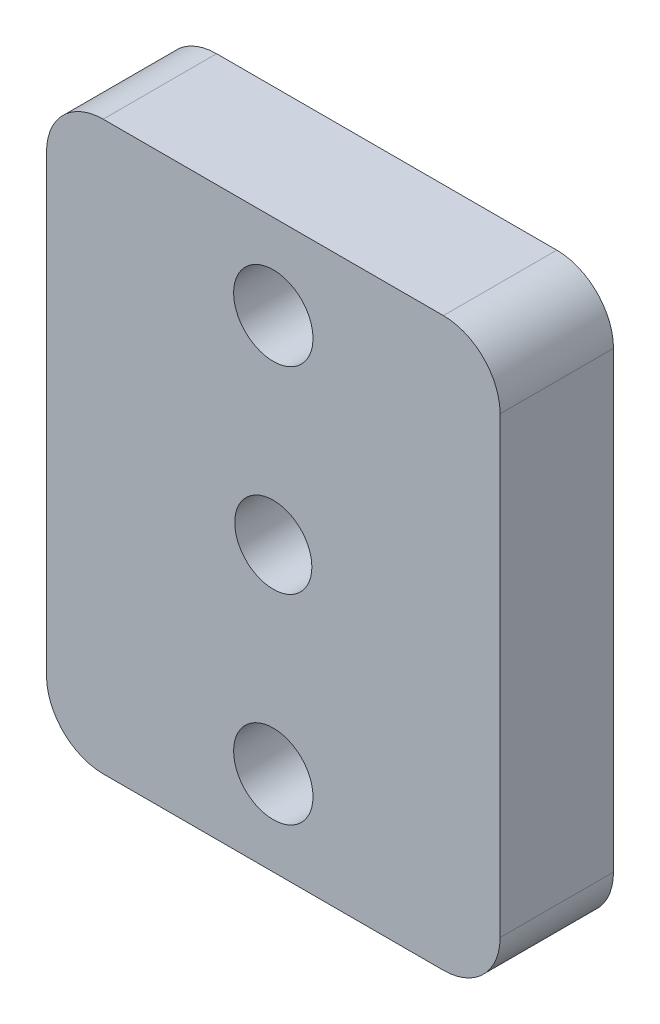
from build123d import *

# Parameters (mm, degrees)
ESQUISSE1_W                  = 40
ESQUISSE1_H                  = 50
BOSS_EXTRU_1_DEPTH           = 10
ENL_V_MAT_EXTRU_1_DEPTH      = 65.807406984
ENL_V_MAT_EXTRU_1_DEPTH_BACK = 65.807406984
ESQUISSE2_R                  = 3.4
ESQUISSE2_R_2                = 3.5
CONG_1_R                     = 5


with BuildPart() as part:
    # Esquisse1 → Boss.-Extru.1 (new body)
    with BuildSketch(Plane.XY):
        with Locations((20, 25)):
            Rectangle(ESQUISSE1_W, ESQUISSE1_H)
    extrude(amount=BOSS_EXTRU_1_DEPTH)

    # Esquisse2 → Enlèv. mat.-Extru.1 (cut, two sides: drawn at the far end of the back side and taken through both)
    with BuildSketch(Plane.XY.offset(10).offset(-ENL_V_MAT_EXTRU_1_DEPTH_BACK)):
        with Locations((20, 25)):
            Circle(ESQUISSE2_R)
        with Locations((20, 7.5)):
            Circle(ESQUISSE2_R_2)
        with Locations(Location((20, 42.5, 0), (0, 0, 180))):
            Circle(ESQUISSE2_R_2)
    extrude(amount=ENL_V_MAT_EXTRU_1_DEPTH + ENL_V_MAT_EXTRU_1_DEPTH_BACK, mode=Mode.SUBTRACT)

    # Congé1
    cong_1_edges = [part.edges().sort_by_distance(p)[0] for p in [
        (0, 50, 5),
        (40, 50, 5),
        (40, 0, 5),
        (0, 0, 5),
    ]]
    fillet(cong_1_edges, radius=CONG_1_R)


solid = part.part
